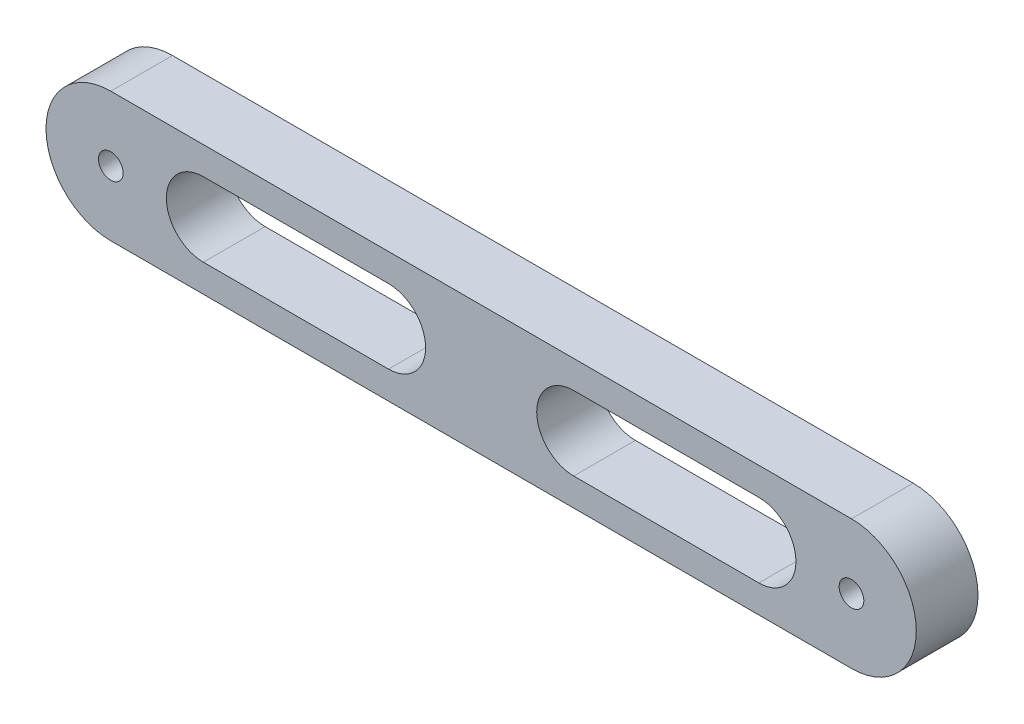
from build123d import *

# Parameters (mm, degrees)
EXTRUDE_1_DEPTH     = 50
SKETCH_2_R          = 10
CUT_EXTRUDE_1_DEPTH = 657.515422515


with BuildPart() as part:
    # 草图1 → 凸台-拉伸1 (new body)
    with BuildSketch(Plane.XY):
        with BuildLine():
            Line((0, 52.5), (600, 52.5))
            ThreePointArc((600, 52.5), (652.5, 0), (600, -52.5))
            Line((600, -52.5), (0, -52.5))
            ThreePointArc((0, -52.5), (-52.5, 0), (0, 52.5))
        make_face()
    extrude(amount=EXTRUDE_1_DEPTH)

    # 草图2 → 切除-拉伸1 (cut, through all)
    with BuildSketch(Plane.XY.offset(50)):
        with BuildLine():
            Line((375, -30), (525, -30))
            ThreePointArc((525, -30), (555, 0), (525, 30))
            Line((525, 30), (375, 30))
            ThreePointArc((375, 30), (345, 0), (375, -30))
        make_face()
        with Locations((600, 0)):
            Circle(SKETCH_2_R)
        Circle(SKETCH_2_R)
        with BuildLine():
            Line((75, -30), (225, -30))
            ThreePointArc((225, -30), (255, 0), (225, 30))
            Line((225, 30), (75, 30))
            ThreePointArc((75, 30), (45, 0), (75, -30))
        make_face()
    extrude(amount=-CUT_EXTRUDE_1_DEPTH, mode=Mode.SUBTRACT)


solid = part.part
